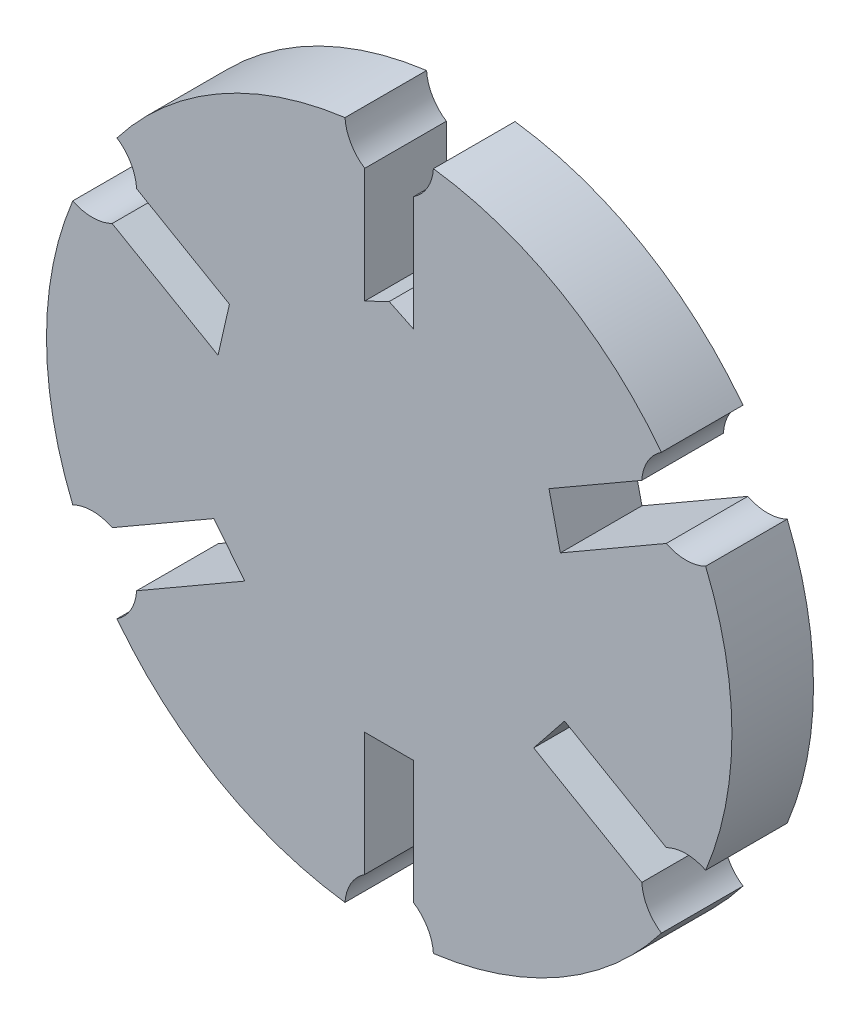
from build123d import *

# Parameters (mm, degrees)
BOSS_EXTRUDE3_DEPTH = 10


with BuildPart() as part:
    # Sketch1 → Boss-Extrude3 (new body)
    with BuildSketch(Plane.XY):
        with BuildLine():
            Line((19.582862725, 14.770272681), (30.960060849, 21.33890108))
            ThreePointArc((30.960060849, 21.33890108), (31.673214627, 23.712775149), (33.366924266, 25.522530399))
            ThreePointArc((33.366924266, 25.522530399), (21.00447091, 36.380810803), (5.419697562, 41.65786926))
            ThreePointArc((5.419697562, 41.65786926), (4.69925836, 39.286196061), (3, 37.481649738))
            Line((3, 37.481649738), (3, 23.393619776))
            Line((3, 23.393619776), (0, 24.838343632))
            Line((0, 24.838343632), (-3, 23.393619776))
            Line((-3, 23.393619776), (-3, 37.481649738))
            ThreePointArc((-3, 37.481649738), (-4.69925836, 39.286196061), (-5.419697562, 41.65786926))
            ThreePointArc((-5.419697562, 41.65786926), (-21.00447091, 36.380810803), (-33.366924266, 25.522530399))
            ThreePointArc((-33.366924266, 25.522530399), (-31.673214627, 23.712775149), (-30.960060849, 21.33890108))
            Line((-30.960060849, 21.33890108), (-19.582862725, 14.770272681))
            Line((-19.582862725, 14.770272681), (-20.980061971, 8.648742811))
            Line((-20.980061971, 8.648742811), (-33.960060849, 16.142748658))
            ThreePointArc((-33.960060849, 16.142748658), (-36.372472987, 15.573420912), (-38.786621827, 16.135338861))
            ThreePointArc((-38.786621827, 16.135338861), (-42.008941821, 0), (-38.786621827, -16.135338861))
            ThreePointArc((-38.786621827, -16.135338861), (-36.372472987, -15.573420912), (-33.960060849, -16.142748658))
            Line((-33.960060849, -16.142748658), (-21.490919097, -8.943686311))
            Line((-21.490919097, -8.943686311), (-17.707725135, -13.687661489))
            Line((-17.707725135, -13.687661489), (-30.960060849, -21.33890108))
            ThreePointArc((-30.960060849, -21.33890108), (-31.673214627, -23.712775149), (-33.366924266, -25.522530399))
            ThreePointArc((-33.366924266, -25.522530399), (-21.00447091, -36.380810803), (-5.419697562, -41.65786926))
            ThreePointArc((-5.419697562, -41.65786926), (-4.69925836, -39.286196061), (-3, -37.481649738))
            Line((-3, -37.481649738), (-3, -22.378574343))
            Line((-3, -22.378574343), (3, -22.378574343))
            Line((3, -22.378574343), (3, -37.481649738))
            ThreePointArc((3, -37.481649738), (4.69925836, -39.286196061), (5.419697562, -41.65786926))
            ThreePointArc((5.419697562, -41.65786926), (21.00447091, -36.380810803), (33.366924266, -25.522530399))
            ThreePointArc((33.366924266, -25.522530399), (31.673214627, -23.712775149), (30.960060849, -21.33890108))
            Line((30.960060849, -21.33890108), (17.707725135, -13.687661489))
            Line((17.707725135, -13.687661489), (21.490919097, -8.943686311))
            Line((21.490919097, -8.943686311), (33.960060849, -16.142748658))
            ThreePointArc((33.960060849, -16.142748658), (36.372472987, -15.573420912), (38.786621827, -16.135338861))
            ThreePointArc((38.786621827, -16.135338861), (42.008941821, 0), (38.786621827, 16.135338861))
            ThreePointArc((38.786621827, 16.135338861), (36.372472987, 15.573420912), (33.960060849, 16.142748658))
            Line((33.960060849, 16.142748658), (20.980061971, 8.648742811))
            Line((20.980061971, 8.648742811), (19.582862725, 14.770272681))
        make_face()
    extrude(amount=BOSS_EXTRUDE3_DEPTH)


solid = part.part
